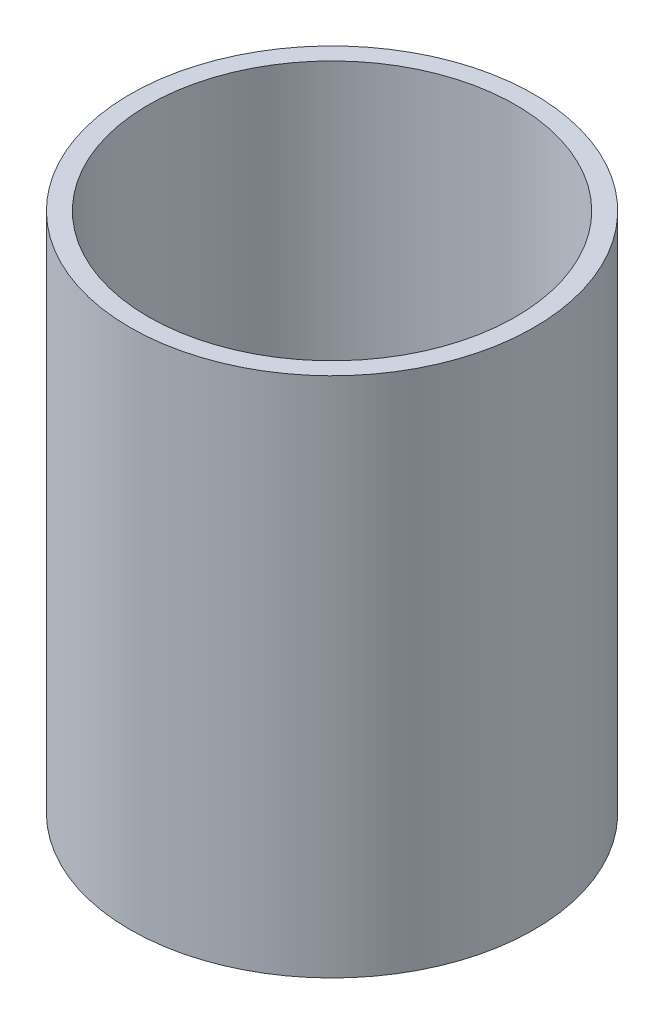
from build123d import *

# Parameters (mm, degrees)
SKETCH1_R           = 27.5
SKETCH1_R_2         = 25
BOSS_EXTRUDE1_DEPTH = 71


with BuildPart() as part:
    # Sketch1 → Boss-Extrude1 (new body)
    with BuildSketch(Plane(origin=(0, 0, 0), x_dir=(1, 0, 0), z_dir=(0, 1, 0))):
        with Locations(Location((0, 0, 0), (0, 0, 270))):
            Circle(SKETCH1_R)
        with Locations(Location((0, 0, 0), (0, 0, 270))):
            Circle(SKETCH1_R_2, mode=Mode.SUBTRACT)
    extrude(amount=BOSS_EXTRUDE1_DEPTH)


solid = part.part
